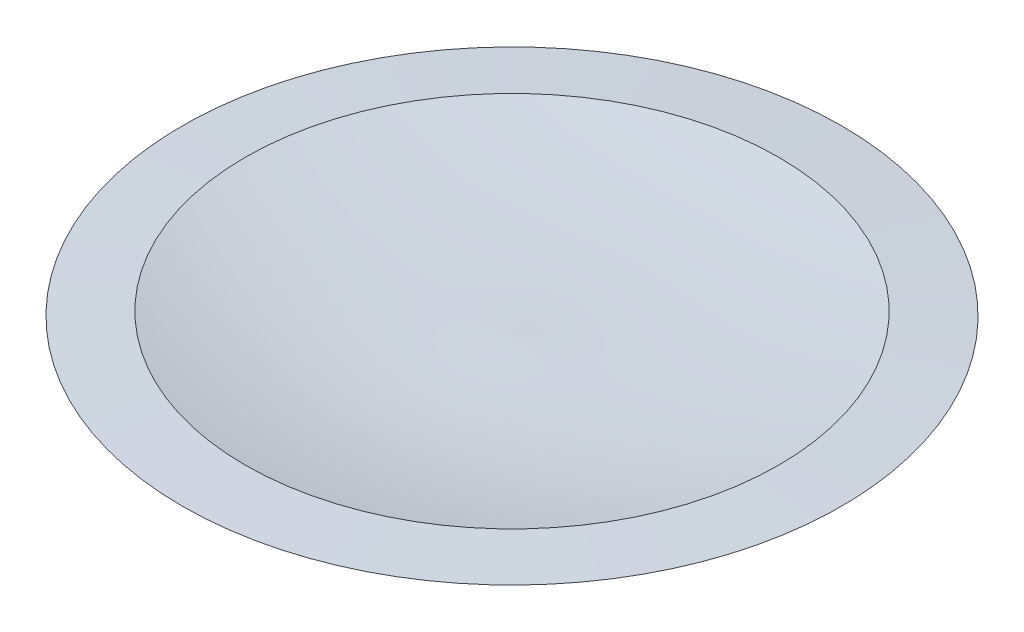
from build123d import *


with BuildPart() as part:
    # Sketch1 → Revolve3 (revolve)
    with BuildSketch(Plane.XY, mode=Mode.PRIVATE) as revolve3_sk:
        with BuildLine():
            Line((45.216643697, 0), (49.105618679, 3.888974982))
            add(Edge.make_bspline(
                [(49.105618679, 3.888974982), (89.503501125, 4.335662509), (127, 17.133241645)],
                knots=[0, 0, 0, 1, 1, 1], degree=2))
            Line((127, 17.133241645), (102.774347298, 18.73826956))
            add(Edge.make_bspline(
                [(0, 10.45590297), (52.446410695, 7.204309034), (102.774347298, 18.73826956)],
                knots=[0, 0, 0, 1, 1, 1], degree=2))
            Line((0, 10.45590297), (0, 0))
            Line((0, 0), (45.216643697, 0))
        make_face()
    revolve(revolve3_sk.sketch.rotate(Axis((0, 0, 0), (0, 1, 0)), 90), axis=Axis((0, 0, 0), (0, 1, 0)))


solid = part.part
